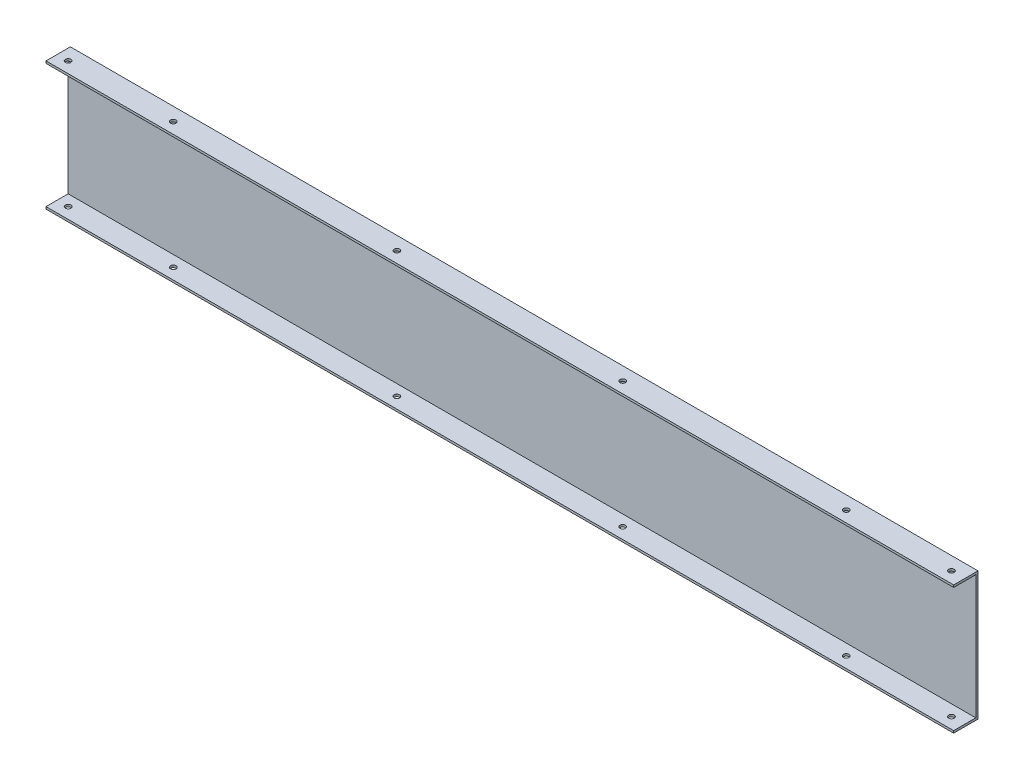
from build123d import *

# Parameters (mm, degrees)
SKETCH_1_W          = 820
SKETCH_1_H          = 116
EXTRUDE_1_DEPTH     = 2
SKETCH_2_W          = 820
SKETCH_2_H          = 2
EXTRUDE_2_DEPTH     = 20
SKETCH_3_R          = 2.5
CUT_EXTRUDE_2_DEPTH = 116


with BuildPart() as part:
    # 草图1 → 凸台-拉伸1 (new body)
    with BuildSketch(Plane.XY):
        with Locations((395.921840051, 50.211278088)):
            Rectangle(SKETCH_1_W, SKETCH_1_H)
    extrude(amount=EXTRUDE_1_DEPTH)

    # 草图2 → 凸台-拉伸2 (add)
    with BuildSketch(Plane.XY.offset(2)):
        with Locations((395.921840051, 107.211278088)):
            Rectangle(SKETCH_2_W, SKETCH_2_H)
        with Locations((395.921840051, -6.788721912)):
            Rectangle(SKETCH_2_W, SKETCH_2_H)
    extrude(amount=EXTRUDE_2_DEPTH)

    # 草图3 → 切除-拉伸2 (cut)
    with BuildSketch(Plane(origin=(0, 108.211278088, 0), x_dir=(1, 0, 0), z_dir=(0, 1, 0))):
        with Locations(Location((698.921840051, -12, 0), (0, 0, 270))):
            Circle(SKETCH_3_R)
        with Locations(Location((793.921840051, -12, 0), (0, 0, 270))):
            Circle(SKETCH_3_R)
        with Locations(Location((-4.078159949, -12, 0), (0, 0, 270))):
            Circle(SKETCH_3_R)
        with Locations(Location((90.921840051, -12, 0), (0, 0, 270))):
            Circle(SKETCH_3_R)
        with Locations(Location((292.921840051, -12, 0), (0, 0, 270))):
            Circle(SKETCH_3_R)
        with Locations(Location((496.921840051, -12, 0), (0, 0, 270))):
            Circle(SKETCH_3_R)
    extrude(amount=-CUT_EXTRUDE_2_DEPTH, mode=Mode.SUBTRACT)


solid = part.part
